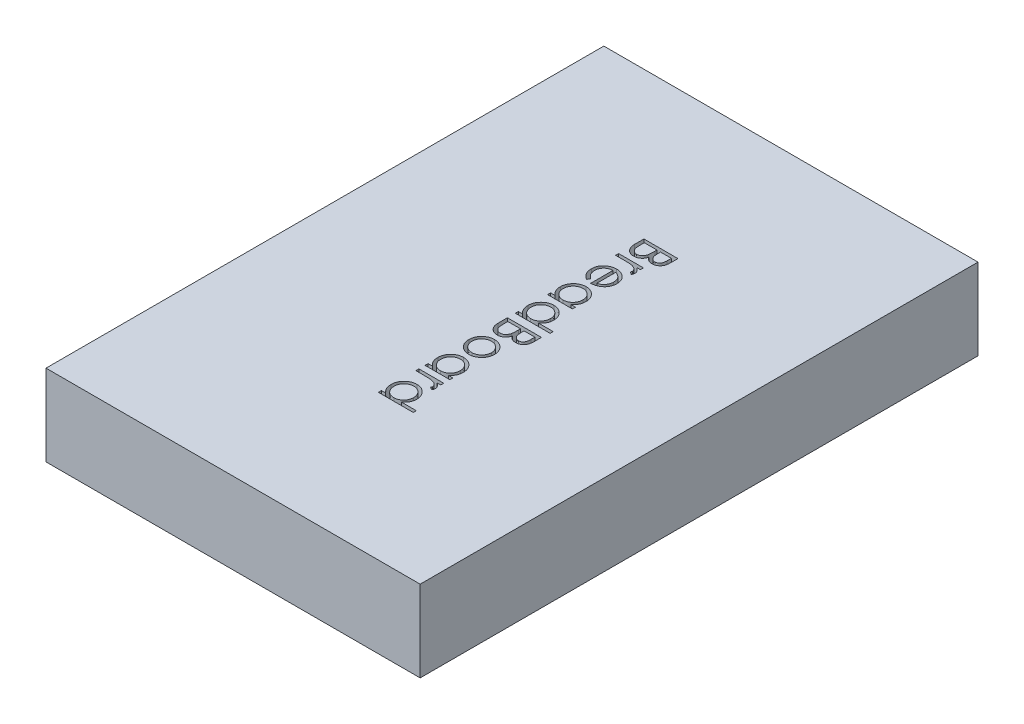
from build123d import *

# Parameters (mm, degrees)
SKETCH1_W           = 55
SKETCH1_H           = 82
BOSS_EXTRUDE1_DEPTH = 11.938
CUT_EXTRUDE1_DEPTH  = 2.54


with BuildPart() as part:
    # Sketch1 → Boss-Extrude1 (new body)
    with BuildSketch(Plane(origin=(0, 0, 0), x_dir=(1, 0, 0), z_dir=(0, 1, 0))):
        with Locations((-90.622842697, 15.300419944)):
            Rectangle(SKETCH1_W, SKETCH1_H)
    extrude(amount=BOSS_EXTRUDE1_DEPTH)

    # Sketch2 → Cut-Extrude1 (cut)
    # profile 1 of 10: a face of its own
    with BuildSketch(Plane(origin=(0, 11.938, 0), x_dir=(1, 0, 0), z_dir=(0, 1, 0))):
        with BuildLine():
            Line((-85.622842697, 34.691445585), (-85.622842697, 33.715884687))
            add(Edge.make_bspline(
                [(-85.622842697, 33.715884687), (-85.623093769, 33.668129719), (-85.623580409, 33.575568704), (-85.631127739, 33.440969501), (-85.641418696, 33.314899772), (-85.6577474, 33.197322954), (-85.677449938, 33.088293379), (-85.701309676, 32.987482469), (-85.729919124, 32.895210794), (-85.775413811, 32.785049742), (-85.843018337, 32.659448798), (-85.942916288, 32.523451094), (-86.065105521, 32.407159324), (-86.202937886, 32.306893156), (-86.354560417, 32.227177271), (-86.516359258, 32.169506846), (-86.68624746, 32.132995596), (-86.802880572, 32.12924069), (-86.861825068, 32.127343021)],
                knots=[0, 0, 0, 0, 1.001505555, 1.941167018, 2.826882275, 3.653841531, 4.429895133, 5.150066043, 5.825578002, 6.45369114, 7.647487171, 8.808567382, 9.977351308, 11.170798116, 12.373658725, 13.556498008, 14.765093433, 16, 16, 16, 16], degree=3))
            add(Edge.make_bspline(
                [(-86.861825068, 32.127343021), (-86.917052361, 32.128874578), (-87.025579199, 32.131884231), (-87.184056012, 32.161643734), (-87.335533942, 32.20595139), (-87.47814558, 32.270273014), (-87.610058058, 32.353010527), (-87.730487426, 32.452575575), (-87.836515177, 32.57112078), (-87.895543353, 32.660080297), (-87.925526992, 32.7052677)],
                knots=[0, 0, 0, 0, 1.044266239, 2.052081639, 3.041743201, 4.026043445, 5.00270663, 5.980942822, 6.97441044, 8, 8, 8, 8], degree=3))
            add(Edge.make_bspline(
                [(-87.925526992, 32.7052677), (-87.947317304, 32.648457577), (-87.989007571, 32.539765737), (-88.063116527, 32.390083859), (-88.142812626, 32.260605712), (-88.230305402, 32.15118878), (-88.32579265, 32.059021947), (-88.427362291, 31.976254218), (-88.54001474, 31.906913419), (-88.660542296, 31.847343827), (-88.788099039, 31.800463182), (-88.9221016, 31.76729205), (-89.06105159, 31.746910004), (-89.155760128, 31.744130709), (-89.203571863, 31.742727636)],
                knots=[0, 0, 0, 0, 1.272302504, 2.434229863, 3.488457646, 4.447234501, 5.35599188, 6.26022912, 7.18267843, 8.11661068, 9.06895546, 10.019249207, 11.000057067, 12, 12, 12, 12], degree=3))
            add(Edge.make_bspline(
                [(-89.203571863, 31.742727636), (-89.252381404, 31.744123568), (-89.348415542, 31.746870104), (-89.489498259, 31.767120951), (-89.624305083, 31.801442666), (-89.753794511, 31.848602575), (-89.877233586, 31.910501909), (-89.996168281, 31.984207884), (-90.107430254, 32.073917397), (-90.213665439, 32.173911348), (-90.309127399, 32.287165255), (-90.394115051, 32.409339626), (-90.464329321, 32.542191733), (-90.522573774, 32.683661389), (-90.567712927, 32.834688665), (-90.59905062, 32.994713589), (-90.620215163, 33.163770936), (-90.621951991, 33.279785701), (-90.622842697, 33.339282123)],
                knots=[0, 0, 0, 0, 0.978404568, 1.925038397, 2.85041836, 3.763147166, 4.682162379, 5.614488577, 6.562659439, 7.54271123, 8.535210642, 9.526693784, 10.520907202, 11.541451354, 12.589717429, 13.675358278, 14.807842563, 16, 16, 16, 16], degree=3))
            Line((-90.622842697, 33.339282123), (-90.622842697, 34.691445585))
            Line((-90.622842697, 34.691445585), (-85.622842697, 34.691445585))
        make_face()
        with BuildLine():
            Line((-86.135663209, 34.242727636), (-87.738227312, 34.242727636))
            Line((-87.738227312, 34.242727636), (-87.738227312, 33.941245264))
            add(Edge.make_bspline(
                [(-87.738227312, 33.941245264), (-87.737660748, 33.89717516), (-87.73656603, 33.812022737), (-87.733331347, 33.688380893), (-87.724670721, 33.573899009), (-87.715510682, 33.468182601), (-87.701406095, 33.371940228), (-87.684146043, 33.284849695), (-87.666051541, 33.206128657), (-87.635192679, 33.115387274), (-87.590048921, 33.012487748), (-87.518342093, 32.903490157), (-87.435254112, 32.80583978), (-87.337613305, 32.724302946), (-87.231011175, 32.657020805), (-87.115438219, 32.612119624), (-86.995406366, 32.580271807), (-86.912787123, 32.57747896), (-86.870839492, 32.576060969)],
                knots=[0, 0, 0, 0, 1.156481963, 2.23455883, 3.244418989, 4.168404366, 5.01828131, 5.794834307, 6.498111525, 7.13526334, 8.307595709, 9.435046769, 10.546766856, 11.659452936, 12.760769924, 13.837671619, 14.902137667, 16, 16, 16, 16], degree=3))
            add(Edge.make_bspline(
                [(-86.870839492, 32.576060969), (-86.843075319, 32.576770166), (-86.788612863, 32.578161333), (-86.709524959, 32.590822605), (-86.634190941, 32.609194234), (-86.564343439, 32.637896322), (-86.497997187, 32.67260308), (-86.438099066, 32.717750274), (-86.3813675, 32.768736763), (-86.329885532, 32.828615432), (-86.283757487, 32.897096345), (-86.243168854, 32.974831998), (-86.211151379, 33.062750595), (-86.182429999, 33.158858683), (-86.162500492, 33.264694384), (-86.14583677, 33.379223541), (-86.137366139, 33.503417738), (-86.136243514, 33.589339063), (-86.135663209, 33.633753277)],
                knots=[0, 0, 0, 0, 0.911752476, 1.788502045, 2.626783689, 3.45400582, 4.26402138, 5.080402872, 5.911472738, 6.767166405, 7.66795952, 8.620018292, 9.640966946, 10.73819047, 11.913090943, 13.176185384, 14.540321519, 16, 16, 16, 16], degree=3))
            Line((-86.135663209, 33.633753277), (-86.135663209, 34.242727636))
        make_face(mode=Mode.SUBTRACT)
        with BuildLine():
            Line((-88.251047825, 34.242727636), (-90.110022184, 34.242727636))
            Line((-90.110022184, 34.242727636), (-90.110022184, 33.6037052))
            add(Edge.make_bspline(
                [(-90.110022184, 33.6037052), (-90.109475888, 33.557963651), (-90.108422975, 33.469802844), (-90.104948126, 33.342518391), (-90.097210156, 33.22486358), (-90.084595199, 33.116770707), (-90.071487161, 33.017288262), (-90.053345001, 32.927404605), (-90.032719559, 32.846981936), (-90.000800711, 32.753741664), (-89.951298857, 32.648679713), (-89.876174494, 32.535538569), (-89.787853895, 32.433942467), (-89.684345405, 32.348657628), (-89.572649718, 32.278232751), (-89.45335104, 32.228839676), (-89.330088817, 32.197080637), (-89.245829078, 32.193327717), (-89.203571863, 32.191445585)],
                knots=[0, 0, 0, 0, 1.159821618, 2.235403267, 3.228114831, 4.14795534, 4.994323282, 5.771256229, 6.471395042, 7.097801288, 8.267864287, 9.404187171, 10.531774336, 11.667624178, 12.792825787, 13.866573821, 14.930062559, 16, 16, 16, 16], degree=3))
            add(Edge.make_bspline(
                [(-89.203571863, 32.191445585), (-89.177149387, 32.191830287), (-89.124730633, 32.192593485), (-89.047757865, 32.204536258), (-88.972864164, 32.221197206), (-88.901182033, 32.24532369), (-88.83154505, 32.275745231), (-88.765166182, 32.313923112), (-88.700458287, 32.35801133), (-88.618746879, 32.426979872), (-88.524569413, 32.527201144), (-88.432376427, 32.669647561), (-88.358021444, 32.83160568), (-88.326450902, 32.949073856), (-88.310142376, 33.00975488)],
                knots=[0, 0, 0, 0, 0.723503378, 1.435336582, 2.130201219, 2.824764462, 3.504949994, 4.209866579, 4.920640069, 5.648298893, 7.13757748, 8.670694625, 10.280166878, 12, 12, 12, 12], degree=3))
            add(Edge.make_bspline(
                [(-88.310142376, 33.00975488), (-88.30520621, 33.034082137), (-88.294503584, 33.086828648), (-88.283213245, 33.172839914), (-88.273085443, 33.271363276), (-88.265790597, 33.381977627), (-88.257959706, 33.505122895), (-88.255022644, 33.640759519), (-88.251437806, 33.788983387), (-88.251181144, 33.891829759), (-88.251047825, 33.945251675)],
                knots=[0, 0, 0, 0, 0.634452549, 1.375623993, 2.216454381, 3.166361212, 4.209414599, 5.370755378, 6.634280627, 8, 8, 8, 8], degree=3))
            Line((-88.251047825, 33.945251675), (-88.251047825, 34.242727636))
        make_face(mode=Mode.SUBTRACT)
    # profile 2 of 10: a face of its own
    with BuildSketch(Plane(origin=(0, 11.938, 0), x_dir=(1, 0, 0), z_dir=(0, 1, 0))):
        with BuildLine():
            Line((-86.968996543, 30.973496867), (-86.968996543, 30.524778918))
            Line((-86.968996543, 30.524778918), (-87.50685712, 30.524778918))
            add(Edge.make_bspline(
                [(-87.50685712, 30.524778918), (-87.456772125, 30.4916561), (-87.360984963, 30.428308967), (-87.234382516, 30.322953144), (-87.129091658, 30.215069513), (-87.046140514, 30.103316402), (-86.98350863, 29.988628027), (-86.937247354, 29.872911483), (-86.910356826, 29.753769663), (-86.906717367, 29.673545414), (-86.904893979, 29.633352636)],
                knots=[0, 0, 0, 0, 1.280622107, 2.44917983, 3.507334186, 4.490567186, 5.408878616, 6.288712897, 7.142636019, 8, 8, 8, 8], degree=3))
            add(Edge.make_bspline(
                [(-86.904893979, 29.633352636), (-86.906556683, 29.602162067), (-86.909960487, 29.538310304), (-86.935072486, 29.441358711), (-86.973643874, 29.341056978), (-87.010803183, 29.276330267), (-87.030094299, 29.242727636)],
                knots=[0, 0, 0, 0, 0.90119973, 1.844890732, 2.881183062, 4, 4, 4, 4], degree=3))
            Line((-87.030094299, 29.242727636), (-87.418716094, 29.489121867))
            add(Edge.make_bspline(
                [(-87.418716094, 29.489121867), (-87.409087142, 29.510706183), (-87.390809549, 29.551677346), (-87.369178106, 29.611612441), (-87.356441083, 29.666871494), (-87.354511487, 29.702076577), (-87.353611927, 29.718488854)],
                knots=[0, 0, 0, 0, 1.180555205, 2.24091978, 3.179933427, 4, 4, 4, 4], degree=3))
            add(Edge.make_bspline(
                [(-87.353611927, 29.718488854), (-87.355923734, 29.754858882), (-87.360597031, 29.82838059), (-87.399954562, 29.93616666), (-87.46086934, 30.041232186), (-87.530830565, 30.123610701), (-87.597001797, 30.187883817), (-87.655101869, 30.233775095), (-87.720205399, 30.275899944), (-87.791250367, 30.316141183), (-87.869435114, 30.352807882), (-87.953982778, 30.387028674), (-88.044990043, 30.417969954), (-88.108393652, 30.435613153), (-88.140871543, 30.444650713)],
                knots=[0, 0, 0, 0, 1.135927944, 2.296268816, 3.551388088, 4.924624343, 5.663947748, 6.437790805, 7.238014523, 8.089896346, 8.992356783, 9.939655789, 10.944608424, 12, 12, 12, 12], degree=3))
            add(Edge.make_bspline(
                [(-88.140871543, 30.444650713), (-88.169838934, 30.451411275), (-88.233999503, 30.466385406), (-88.341640253, 30.480944746), (-88.468816908, 30.495329771), (-88.615883469, 30.505467798), (-88.782472675, 30.514865001), (-88.968838312, 30.520165118), (-89.17517167, 30.524598176), (-89.319420746, 30.524716843), (-89.394877953, 30.524778918)],
                knots=[0, 0, 0, 0, 0.566838948, 1.255505196, 2.06880316, 3.007127437, 4.065329342, 5.249902469, 6.561414163, 8, 8, 8, 8], degree=3))
            Line((-89.394877953, 30.524778918), (-90.622842697, 30.524778918))
            Line((-90.622842697, 30.524778918), (-90.622842697, 30.973496867))
            Line((-90.622842697, 30.973496867), (-86.968996543, 30.973496867))
        make_face()
    # profile 3 of 10: a face of its own
    with BuildSketch(Plane(origin=(0, 11.938, 0), x_dir=(1, 0, 0), z_dir=(0, 1, 0))):
        with BuildLine():
            Line((-89.468996543, 25.731109046), (-89.678331479, 25.332471226))
            add(Edge.make_bspline(
                [(-89.678331479, 25.332471226), (-89.734674486, 25.36424236), (-89.844295665, 25.426056406), (-89.994976089, 25.532280249), (-90.130063389, 25.64376733), (-90.247466342, 25.764362788), (-90.349256021, 25.892581315), (-90.437727083, 26.028611262), (-90.513948929, 26.171998075), (-90.577824979, 26.323247208), (-90.626996906, 26.483665403), (-90.661712852, 26.653698884), (-90.68317589, 26.833657393), (-90.685668777, 26.957009187), (-90.686945261, 27.020171546)],
                knots=[0, 0, 0, 0, 1.120373846, 2.179803828, 3.190307243, 4.151866639, 5.090753574, 6.023181945, 6.960194942, 7.901556876, 8.864247182, 9.862852693, 10.905672442, 12, 12, 12, 12], degree=3))
            add(Edge.make_bspline(
                [(-90.686945261, 27.020171546), (-90.685306439, 27.090374371), (-90.682109572, 27.227319744), (-90.65454891, 27.426662245), (-90.609588391, 27.614347112), (-90.546780497, 27.790363887), (-90.464741382, 27.95428119), (-90.364799566, 28.106426014), (-90.247466634, 28.24759394), (-90.111733182, 28.373353538), (-89.966457201, 28.48651928), (-89.815149636, 28.586557184), (-89.657733541, 28.669607743), (-89.496657031, 28.739449368), (-89.330437736, 28.792365847), (-89.159986654, 28.831100805), (-88.984459181, 28.853003793), (-88.865755226, 28.856400512), (-88.805935645, 28.858112252)],
                knots=[0, 0, 0, 0, 1.145226127, 2.234004399, 3.276654467, 4.290038057, 5.276870678, 6.260645262, 7.254731018, 8.264593254, 9.273837991, 10.257612574, 11.220387342, 12.174754112, 13.118989047, 14.062768009, 15.023752772, 16, 16, 16, 16], degree=3))
            add(Edge.make_bspline(
                [(-88.805935645, 28.858112252), (-88.749800173, 28.856599192), (-88.638547081, 28.853600509), (-88.473882017, 28.834699384), (-88.313841371, 28.801201823), (-88.158292159, 28.755235646), (-88.007494825, 28.695876723), (-87.861357591, 28.623259267), (-87.720035963, 28.537270156), (-87.630888629, 28.470880622), (-87.585983722, 28.437439175)],
                knots=[0, 0, 0, 0, 1.024358464, 2.0301432, 3.019427413, 4.004406732, 4.986367066, 5.972626655, 6.978780325, 8, 8, 8, 8], degree=3))
            add(Edge.make_bspline(
                [(-87.585983722, 28.437439175), (-87.531885336, 28.392142485), (-87.425402264, 28.30298399), (-87.28549037, 28.152189196), (-87.168284977, 27.988903202), (-87.071131926, 27.815172307), (-86.99731243, 27.628977344), (-86.942301598, 27.432821214), (-86.911475868, 27.224470377), (-86.90712182, 27.082034347), (-86.904893979, 27.009153918)],
                knots=[0, 0, 0, 0, 1.030682036, 2.02871468, 2.997146059, 3.962720338, 4.930598197, 5.918074684, 6.934738563, 8, 8, 8, 8], degree=3))
            add(Edge.make_bspline(
                [(-86.904893979, 27.009153918), (-86.906828334, 26.934228768), (-86.910623099, 26.787242702), (-86.945803575, 26.572911101), (-87.001592939, 26.370110077), (-87.080384068, 26.178920785), (-87.182040571, 25.999323841), (-87.307957487, 25.832486628), (-87.45426904, 25.675555895), (-87.566787911, 25.584257926), (-87.62404462, 25.537799752)],
                knots=[0, 0, 0, 0, 1.056321875, 2.072262726, 3.055038591, 4.01806755, 4.982017516, 5.957941055, 6.960871419, 8, 8, 8, 8], degree=3))
            add(Edge.make_bspline(
                [(-87.62404462, 25.537799752), (-87.667192593, 25.50618984), (-87.753201334, 25.443180421), (-87.893445844, 25.364255992), (-88.040175265, 25.295745428), (-88.195761403, 25.240984055), (-88.358360804, 25.196641911), (-88.529135868, 25.164560741), (-88.708035741, 25.145747), (-88.82993082, 25.142048861), (-88.892073466, 25.140163534)],
                knots=[0, 0, 0, 0, 0.94817472, 1.890038105, 2.849395472, 3.817997239, 4.812318967, 5.836947057, 6.897266129, 8, 8, 8, 8], degree=3))
            Line((-88.892073466, 25.140163534), (-88.892073466, 28.409394303))
            add(Edge.make_bspline(
                [(-88.892073466, 28.409394303), (-88.940216012, 28.407192776), (-89.034886389, 28.402863564), (-89.173429919, 28.38272876), (-89.305341683, 28.350837221), (-89.430059638, 28.306507054), (-89.547993273, 28.2509216), (-89.659955373, 28.184971038), (-89.764245582, 28.105809452), (-89.862215369, 28.017660032), (-89.949428859, 27.919493599), (-90.02754949, 27.81625559), (-90.092663259, 27.706590984), (-90.146311996, 27.591605295), (-90.187603657, 27.470702201), (-90.216038499, 27.344051722), (-90.235034404, 27.212047844), (-90.237150179, 27.122069131), (-90.238227312, 27.07626129)],
                knots=[0, 0, 0, 0, 1.094405546, 2.152104367, 3.174987145, 4.173015398, 5.153654967, 6.133208507, 7.119289451, 8.123438607, 9.122504012, 10.097966803, 11.060604936, 12.014205423, 12.976096155, 13.956823727, 14.959826266, 16, 16, 16, 16], degree=3))
            add(Edge.make_bspline(
                [(-90.238227312, 27.07626129), (-90.237364701, 27.031472796), (-90.235653114, 26.942603831), (-90.218762884, 26.809951653), (-90.191899169, 26.679374328), (-90.154976155, 26.551809724), (-90.109491539, 26.430031423), (-90.054970104, 26.316929691), (-89.995348644, 26.212123502), (-89.926085737, 26.114733842), (-89.842184896, 26.020269569), (-89.736284746, 25.927741205), (-89.61232343, 25.827187663), (-89.518645135, 25.764390786), (-89.468996543, 25.731109046)],
                knots=[0, 0, 0, 0, 0.990963276, 1.966261236, 2.95471375, 3.93937425, 4.902926125, 5.828461241, 6.715766441, 7.568835615, 8.469155523, 9.505141836, 10.677749234, 12, 12, 12, 12], degree=3))
        make_face()
        with BuildLine():
            add(Edge.make_bspline(
                [(-88.443355517, 25.588881482), (-88.383822742, 25.605277223), (-88.269241314, 25.636833746), (-88.110948077, 25.703196255), (-87.969450904, 25.776234889), (-87.847086115, 25.864393361), (-87.739166654, 25.965141332), (-87.6439026, 26.080281986), (-87.559086713, 26.209544314), (-87.48742146, 26.352037975), (-87.426441152, 26.502960174), (-87.385546737, 26.660967584), (-87.357533471, 26.822193373), (-87.354924695, 26.931242302), (-87.353611927, 26.986117059)],
                knots=[0, 0, 0, 0, 1.154756201, 2.222533969, 3.206705588, 4.129403772, 5.035894089, 5.963342549, 6.920206228, 7.923656548, 8.944970878, 9.96070521, 10.973801891, 12, 12, 12, 12], degree=3))
            add(Edge.make_bspline(
                [(-87.353611927, 26.986117059), (-87.354489432, 27.030900731), (-87.356224074, 27.119428636), (-87.372556686, 27.249876648), (-87.399905373, 27.375379576), (-87.436326715, 27.496628449), (-87.486507946, 27.611512799), (-87.544154168, 27.723022313), (-87.614978183, 27.828402579), (-87.668912554, 27.894321478), (-87.696160004, 27.927623469)],
                knots=[0, 0, 0, 0, 1.048700258, 2.073059931, 3.073189922, 4.055269162, 5.032885305, 6.005420607, 6.992345662, 8, 8, 8, 8], degree=3))
            add(Edge.make_bspline(
                [(-87.696160004, 27.927623469), (-87.717723312, 27.951471015), (-87.761362192, 27.999732635), (-87.836546773, 28.064219095), (-87.917620433, 28.125962627), (-88.007684897, 28.18215356), (-88.105714581, 28.233692969), (-88.210882632, 28.281921508), (-88.323987104, 28.325330668), (-88.402804874, 28.349753682), (-88.443355517, 28.362318982)],
                knots=[0, 0, 0, 0, 0.879870761, 1.780643979, 2.707998968, 3.669668524, 4.684282772, 5.740141944, 6.837334558, 8, 8, 8, 8], degree=3))
            Line((-88.443355517, 28.362318982), (-88.443355517, 25.588881482))
        make_face(mode=Mode.SUBTRACT)
    # profile 4 of 10: a face of its own
    with BuildSketch(Plane(origin=(0, 11.938, 0), x_dir=(1, 0, 0), z_dir=(0, 1, 0))):
        with BuildLine():
            Line((-86.968996543, 20.524778918), (-90.622842697, 20.524778918))
            Line((-90.622842697, 20.524778918), (-90.622842697, 20.973496867))
            Line((-90.622842697, 20.973496867), (-89.990831479, 20.973496867))
            add(Edge.make_bspline(
                [(-89.990831479, 20.973496867), (-90.048046337, 21.024084559), (-90.159701853, 21.122807076), (-90.305135801, 21.287664198), (-90.42633745, 21.461685795), (-90.52331862, 21.645460327), (-90.596722019, 21.838437946), (-90.648341417, 22.040068329), (-90.681944235, 22.250082751), (-90.685263296, 22.393305346), (-90.686945261, 22.465884687)],
                knots=[0, 0, 0, 0, 1.074295371, 2.096500925, 3.086030275, 4.053105238, 5.014108356, 5.985331429, 6.979048527, 8, 8, 8, 8], degree=3))
            add(Edge.make_bspline(
                [(-90.686945261, 22.465884687), (-90.685193591, 22.530410511), (-90.681739221, 22.657658292), (-90.65493175, 22.844840167), (-90.611903441, 23.024981262), (-90.551988213, 23.198196385), (-90.472922811, 23.363311861), (-90.377242755, 23.521258073), (-90.264419067, 23.672403639), (-90.134935302, 23.813874086), (-89.994446266, 23.944313344), (-89.844165638, 24.058434521), (-89.68615752, 24.155155933), (-89.52046632, 24.234643611), (-89.347213158, 24.296155345), (-89.16651689, 24.338950868), (-88.978678185, 24.365729451), (-88.850764035, 24.369182071), (-88.785903594, 24.370932764)],
                knots=[0, 0, 0, 0, 1.034036272, 2.039165313, 3.024406509, 3.999331371, 4.971254918, 5.953351348, 6.95522652, 7.989525907, 9.023492927, 10.024309745, 11.009187477, 11.988246066, 12.964946762, 13.950187958, 14.960617622, 16, 16, 16, 16], degree=3))
            add(Edge.make_bspline(
                [(-88.785903594, 24.370932764), (-88.722383747, 24.369143241), (-88.596808435, 24.365605451), (-88.412128494, 24.339237407), (-88.23423082, 24.294930656), (-88.063774412, 24.232633272), (-87.900072786, 24.153103324), (-87.744406748, 24.054718522), (-87.594395043, 23.94063847), (-87.454848283, 23.808805146), (-87.326415035, 23.66606495), (-87.213317163, 23.51407374), (-87.117882422, 23.354726694), (-87.040303256, 23.187704299), (-86.978654128, 23.014189221), (-86.935678749, 22.832863359), (-86.910416106, 22.64455131), (-86.906752374, 22.516709094), (-86.904893979, 22.451862252)],
                knots=[0, 0, 0, 0, 1.02050356, 2.017480486, 2.990790918, 3.96161403, 4.928589988, 5.909588639, 6.91611943, 7.952353252, 8.989586576, 9.99823133, 10.991940466, 11.968822692, 12.952985106, 13.945868367, 14.958059758, 16, 16, 16, 16], degree=3))
            add(Edge.make_bspline(
                [(-86.904893979, 22.451862252), (-86.906937909, 22.377288122), (-86.910945959, 22.231051772), (-86.9446557, 22.016876935), (-87.000905839, 21.814079564), (-87.078214095, 21.621490708), (-87.180184326, 21.439857467), (-87.30997662, 21.271415261), (-87.464625875, 21.112773077), (-87.583757969, 21.020824914), (-87.645078274, 20.973496867)],
                knots=[0, 0, 0, 0, 1.03879612, 2.037030165, 3.012306674, 3.966139504, 4.922386257, 5.905048148, 6.921675258, 8, 8, 8, 8], degree=3))
            Line((-87.645078274, 20.973496867), (-86.968996543, 20.973496867))
            Line((-86.968996543, 20.973496867), (-86.968996543, 20.524778918))
        make_face()
        with BuildLine():
            add(Edge.make_bspline(
                [(-87.353611927, 22.445852636), (-87.35594567, 22.511444587), (-87.360552108, 22.640912665), (-87.396514607, 22.830974954), (-87.456348377, 23.012853405), (-87.538184799, 23.185625442), (-87.641063955, 23.346609961), (-87.765593488, 23.490347385), (-87.907813315, 23.618557381), (-88.068919147, 23.724559194), (-88.23966279, 23.813929268), (-88.419502756, 23.875214951), (-88.60344976, 23.915996433), (-88.728261622, 23.920136624), (-88.790911607, 23.922214816)],
                knots=[0, 0, 0, 0, 1.031093775, 2.03521511, 3.029845951, 4.035119871, 5.034286494, 6.024708811, 7.017619509, 8.03559408, 9.050082311, 10.039808432, 11.016071318, 12, 12, 12, 12], degree=3))
            add(Edge.make_bspline(
                [(-88.790911607, 23.922214816), (-88.853174851, 23.919526124), (-88.977457288, 23.914159278), (-89.161950824, 23.876289921), (-89.341066802, 23.810675163), (-89.514175618, 23.72334497), (-89.67561214, 23.614965454), (-89.82061306, 23.487819518), (-89.945642009, 23.342249179), (-90.050291278, 23.180915471), (-90.134528964, 23.00886522), (-90.19392861, 22.827848589), (-90.231436288, 22.641046097), (-90.235956023, 22.513802431), (-90.238227312, 22.449859046)],
                knots=[0, 0, 0, 0, 0.979154363, 1.954470772, 2.947816011, 3.971783346, 4.997163654, 5.998045606, 6.995988793, 8.00538986, 9.015323546, 10.000094788, 10.994993517, 12, 12, 12, 12], degree=3))
            add(Edge.make_bspline(
                [(-90.238227312, 22.449859046), (-90.235891449, 22.384927757), (-90.231257465, 22.256114307), (-90.194693534, 22.065604678), (-90.135603718, 21.880440487), (-90.052595989, 21.703376112), (-89.950192521, 21.538549753), (-89.829779804, 21.390803885), (-89.690913955, 21.264645596), (-89.537072052, 21.158885235), (-89.369207873, 21.07533985), (-89.189722449, 21.016414209), (-89.000026277, 20.980222856), (-88.87020085, 20.975769863), (-88.80393244, 20.973496867)],
                knots=[0, 0, 0, 0, 1.017484689, 2.018529338, 3.030031036, 4.058138743, 5.076350332, 6.065651025, 7.036469986, 8.00785331, 8.984076697, 9.96571663, 10.961615403, 12, 12, 12, 12], degree=3))
            add(Edge.make_bspline(
                [(-88.80393244, 20.973496867), (-88.753449845, 20.974867826), (-88.654084121, 20.977566308), (-88.508187389, 20.998181098), (-88.3685688, 21.030974983), (-88.235075535, 21.077179673), (-88.108467874, 21.137896845), (-87.987753389, 21.211050138), (-87.874056519, 21.298140035), (-87.76752125, 21.396516168), (-87.670836473, 21.505411926), (-87.585619322, 21.621208451), (-87.513502163, 21.743614401), (-87.455789573, 21.872543853), (-87.408772573, 22.007003783), (-87.377718657, 22.148282966), (-87.356327301, 22.294957564), (-87.354526582, 22.39502469), (-87.353611927, 22.445852636)],
                knots=[0, 0, 0, 0, 1.050062701, 2.066855696, 3.059271411, 4.030305351, 4.999747758, 5.975466543, 6.961907836, 7.974539719, 8.98812422, 9.98710676, 10.961662635, 11.93785114, 12.922015094, 13.919620009, 14.94329489, 16, 16, 16, 16], degree=3))
        make_face(mode=Mode.SUBTRACT)
    # profile 5 of 10: a face of its own
    with BuildSketch(Plane(origin=(0, 11.938, 0), x_dir=(1, 0, 0), z_dir=(0, 1, 0))):
        with BuildLine():
            Line((-85.494637568, 15.781189175), (-90.622842697, 15.781189175))
            Line((-90.622842697, 15.781189175), (-90.622842697, 16.229907123))
            Line((-90.622842697, 16.229907123), (-89.990831479, 16.229907123))
            add(Edge.make_bspline(
                [(-89.990831479, 16.229907123), (-90.048046337, 16.280494815), (-90.159701853, 16.379217332), (-90.305135801, 16.544074455), (-90.42633745, 16.718096051), (-90.52331862, 16.901870583), (-90.596722019, 17.094848202), (-90.648341417, 17.296478585), (-90.681944235, 17.506493008), (-90.685263296, 17.649715602), (-90.686945261, 17.722294944)],
                knots=[0, 0, 0, 0, 1.074295371, 2.096500925, 3.086030275, 4.053105238, 5.014108356, 5.985331429, 6.979048527, 8, 8, 8, 8], degree=3))
            add(Edge.make_bspline(
                [(-90.686945261, 17.722294944), (-90.685193591, 17.786820768), (-90.681739221, 17.914068549), (-90.65493175, 18.101250423), (-90.611903441, 18.281391518), (-90.551988213, 18.454606641), (-90.472922811, 18.619722118), (-90.377242755, 18.77766833), (-90.264419067, 18.928813896), (-90.134935302, 19.070284343), (-89.994446266, 19.200723601), (-89.844165638, 19.314844777), (-89.68615752, 19.411566189), (-89.52046632, 19.491053868), (-89.347213158, 19.552565601), (-89.16651689, 19.595361124), (-88.978678185, 19.622139707), (-88.850764035, 19.625592327), (-88.785903594, 19.627343021)],
                knots=[0, 0, 0, 0, 1.034036272, 2.039165313, 3.024406509, 3.999331371, 4.971254918, 5.953351348, 6.95522652, 7.989525907, 9.023492927, 10.024309745, 11.009187477, 11.988246066, 12.964946762, 13.950187958, 14.960617622, 16, 16, 16, 16], degree=3))
            add(Edge.make_bspline(
                [(-88.785903594, 19.627343021), (-88.722383747, 19.625553498), (-88.596808435, 19.622015707), (-88.412128494, 19.595647664), (-88.23423082, 19.551340912), (-88.063774412, 19.489043528), (-87.900072786, 19.409513581), (-87.744406748, 19.311128779), (-87.594395043, 19.197048726), (-87.454848283, 19.065215403), (-87.326415035, 18.922475206), (-87.213317163, 18.770483996), (-87.117882422, 18.61113695), (-87.040303256, 18.444114555), (-86.978654128, 18.270599478), (-86.935678749, 18.089273616), (-86.910416106, 17.900961567), (-86.906752374, 17.77311935), (-86.904893979, 17.708272508)],
                knots=[0, 0, 0, 0, 1.02050356, 2.017480486, 2.990790918, 3.96161403, 4.928589988, 5.909588639, 6.91611943, 7.952353252, 8.989586576, 9.99823133, 10.991940466, 11.968822692, 12.952985106, 13.945868367, 14.958059758, 16, 16, 16, 16], degree=3))
            add(Edge.make_bspline(
                [(-86.904893979, 17.708272508), (-86.907122084, 17.633673741), (-86.911495606, 17.487244652), (-86.948423927, 17.272835114), (-87.009681576, 17.069815393), (-87.094398919, 16.877469745), (-87.203719533, 16.6969415), (-87.336910175, 16.527489271), (-87.495536495, 16.370381035), (-87.615013017, 16.277445663), (-87.676127953, 16.229907123)],
                knots=[0, 0, 0, 0, 1.030970925, 2.023681352, 2.997808474, 3.956843046, 4.921958419, 5.908293655, 6.930045022, 8, 8, 8, 8], degree=3))
            Line((-87.676127953, 16.229907123), (-85.494637568, 16.229907123))
            Line((-85.494637568, 16.229907123), (-85.494637568, 15.781189175))
        make_face()
        with BuildLine():
            add(Edge.make_bspline(
                [(-87.353611927, 17.702262893), (-87.35594567, 17.767854843), (-87.360552108, 17.897322921), (-87.396514607, 18.08738521), (-87.456348377, 18.269263662), (-87.538184799, 18.442035698), (-87.641063955, 18.603020218), (-87.765593488, 18.746757641), (-87.907813315, 18.874967637), (-88.068919147, 18.980969451), (-88.23966279, 19.070339525), (-88.419502756, 19.131625207), (-88.60344976, 19.17240669), (-88.728261622, 19.176546881), (-88.790911607, 19.178625072)],
                knots=[0, 0, 0, 0, 1.031093775, 2.03521511, 3.029845951, 4.035119871, 5.034286494, 6.024708811, 7.017619509, 8.03559408, 9.050082311, 10.039808432, 11.016071318, 12, 12, 12, 12], degree=3))
            add(Edge.make_bspline(
                [(-88.790911607, 19.178625072), (-88.853174851, 19.17593638), (-88.977457288, 19.170569535), (-89.161950824, 19.132700178), (-89.341066802, 19.06708542), (-89.514175618, 18.979755227), (-89.67561214, 18.871375711), (-89.82061306, 18.744229774), (-89.945642009, 18.598659436), (-90.050291278, 18.437325727), (-90.134528964, 18.265275476), (-90.19392861, 18.084258846), (-90.231436288, 17.897456354), (-90.235956023, 17.770212688), (-90.238227312, 17.706269303)],
                knots=[0, 0, 0, 0, 0.979154363, 1.954470772, 2.947816011, 3.971783346, 4.997163654, 5.998045606, 6.995988793, 8.00538986, 9.015323546, 10.000094788, 10.994993517, 12, 12, 12, 12], degree=3))
            add(Edge.make_bspline(
                [(-90.238227312, 17.706269303), (-90.235891449, 17.641338013), (-90.231257465, 17.512524563), (-90.194693534, 17.322014934), (-90.135603718, 17.136850744), (-90.052595989, 16.959786368), (-89.950192521, 16.794960009), (-89.829779804, 16.647214141), (-89.690913955, 16.521055853), (-89.537072052, 16.415295491), (-89.369207873, 16.331750106), (-89.189722449, 16.272824465), (-89.000026277, 16.236633113), (-88.87020085, 16.23218012), (-88.80393244, 16.229907123)],
                knots=[0, 0, 0, 0, 1.017484689, 2.018529338, 3.030031036, 4.058138743, 5.076350332, 6.065651025, 7.036469986, 8.00785331, 8.984076697, 9.96571663, 10.961615403, 12, 12, 12, 12], degree=3))
            add(Edge.make_bspline(
                [(-88.80393244, 16.229907123), (-88.753449845, 16.231278083), (-88.654084121, 16.233976564), (-88.508187389, 16.254591354), (-88.3685688, 16.28738524), (-88.235075535, 16.333589929), (-88.108467874, 16.394307101), (-87.987753389, 16.467460394), (-87.874056519, 16.554550291), (-87.76752125, 16.652926425), (-87.670836473, 16.761822182), (-87.585619322, 16.877618707), (-87.513502163, 17.000024657), (-87.455789573, 17.128954109), (-87.408772573, 17.26341404), (-87.377718657, 17.404693222), (-87.356327301, 17.551367821), (-87.354526582, 17.651434946), (-87.353611927, 17.702262893)],
                knots=[0, 0, 0, 0, 1.050062701, 2.066855696, 3.059271411, 4.030305351, 4.999747758, 5.975466543, 6.961907836, 7.974539719, 8.98812422, 9.98710676, 10.961662635, 11.93785114, 12.922015094, 13.919620009, 14.94329489, 16, 16, 16, 16], degree=3))
        make_face(mode=Mode.SUBTRACT)
    # profile 6 of 10: a face of its own
    with BuildSketch(Plane(origin=(0, 11.938, 0), x_dir=(1, 0, 0), z_dir=(0, 1, 0))):
        with BuildLine():
            Line((-85.622842697, 14.627343021), (-85.622842697, 13.651782123))
            add(Edge.make_bspline(
                [(-85.622842697, 13.651782123), (-85.623093769, 13.604027154), (-85.623580409, 13.51146614), (-85.631127739, 13.376866937), (-85.641418696, 13.250797208), (-85.6577474, 13.13322039), (-85.677449938, 13.024190815), (-85.701309676, 12.923379905), (-85.729919124, 12.83110823), (-85.775413811, 12.720947178), (-85.843018337, 12.595346234), (-85.942916288, 12.45934853), (-86.065105521, 12.34305676), (-86.202937886, 12.242790592), (-86.354560417, 12.163074707), (-86.516359258, 12.105404282), (-86.68624746, 12.068893032), (-86.802880572, 12.065138126), (-86.861825068, 12.063240457)],
                knots=[0, 0, 0, 0, 1.001505555, 1.941167018, 2.826882275, 3.653841531, 4.429895133, 5.150066043, 5.825578002, 6.45369114, 7.647487171, 8.808567382, 9.977351308, 11.170798116, 12.373658725, 13.556498008, 14.765093433, 16, 16, 16, 16], degree=3))
            add(Edge.make_bspline(
                [(-86.861825068, 12.063240457), (-86.917052361, 12.064772013), (-87.025579199, 12.067781667), (-87.184056012, 12.09754117), (-87.335533942, 12.141848826), (-87.47814558, 12.20617045), (-87.610058058, 12.288907963), (-87.730487426, 12.388473011), (-87.836515177, 12.507018216), (-87.895543353, 12.595977732), (-87.925526992, 12.641165136)],
                knots=[0, 0, 0, 0, 1.044266239, 2.052081639, 3.041743201, 4.026043445, 5.00270663, 5.980942822, 6.97441044, 8, 8, 8, 8], degree=3))
            add(Edge.make_bspline(
                [(-87.925526992, 12.641165136), (-87.947317304, 12.584355013), (-87.989007571, 12.475663173), (-88.063116527, 12.325981295), (-88.142812626, 12.196503148), (-88.230305402, 12.087086216), (-88.32579265, 11.994919383), (-88.427362291, 11.912151654), (-88.54001474, 11.842810855), (-88.660542296, 11.783241263), (-88.788099039, 11.736360618), (-88.9221016, 11.703189486), (-89.06105159, 11.68280744), (-89.155760128, 11.680028145), (-89.203571863, 11.678625072)],
                knots=[0, 0, 0, 0, 1.272302504, 2.434229863, 3.488457646, 4.447234501, 5.35599188, 6.26022912, 7.18267843, 8.11661068, 9.06895546, 10.019249207, 11.000057067, 12, 12, 12, 12], degree=3))
            add(Edge.make_bspline(
                [(-89.203571863, 11.678625072), (-89.252381404, 11.680021004), (-89.348415542, 11.68276754), (-89.489498259, 11.703018387), (-89.624305083, 11.737340101), (-89.753794511, 11.784500011), (-89.877233586, 11.846399345), (-89.996168281, 11.92010532), (-90.107430254, 12.009814833), (-90.213665439, 12.109808784), (-90.309127399, 12.223062691), (-90.394115051, 12.345237062), (-90.464329321, 12.478089168), (-90.522573774, 12.619558825), (-90.567712927, 12.770586101), (-90.59905062, 12.930611025), (-90.620215163, 13.099668372), (-90.621951991, 13.215683137), (-90.622842697, 13.275179559)],
                knots=[0, 0, 0, 0, 0.978404568, 1.925038397, 2.85041836, 3.763147166, 4.682162379, 5.614488577, 6.562659439, 7.54271123, 8.535210642, 9.526693784, 10.520907202, 11.541451354, 12.589717429, 13.675358278, 14.807842563, 16, 16, 16, 16], degree=3))
            Line((-90.622842697, 13.275179559), (-90.622842697, 14.627343021))
            Line((-90.622842697, 14.627343021), (-85.622842697, 14.627343021))
        make_face()
        with BuildLine():
            Line((-86.135663209, 14.178625072), (-87.738227312, 14.178625072))
            Line((-87.738227312, 14.178625072), (-87.738227312, 13.8771427))
            add(Edge.make_bspline(
                [(-87.738227312, 13.8771427), (-87.737660748, 13.833072596), (-87.73656603, 13.747920173), (-87.733331347, 13.624278328), (-87.724670721, 13.509796444), (-87.715510682, 13.404080037), (-87.701406095, 13.307837664), (-87.684146043, 13.220747131), (-87.666051541, 13.142026093), (-87.635192679, 13.051284709), (-87.590048921, 12.948385184), (-87.518342093, 12.839387593), (-87.435254112, 12.741737216), (-87.337613305, 12.660200382), (-87.231011175, 12.592918241), (-87.115438219, 12.54801706), (-86.995406366, 12.516169243), (-86.912787123, 12.513376396), (-86.870839492, 12.511958405)],
                knots=[0, 0, 0, 0, 1.156481963, 2.23455883, 3.244418989, 4.168404366, 5.01828131, 5.794834307, 6.498111525, 7.13526334, 8.307595709, 9.435046769, 10.546766856, 11.659452936, 12.760769924, 13.837671619, 14.902137667, 16, 16, 16, 16], degree=3))
            add(Edge.make_bspline(
                [(-86.870839492, 12.511958405), (-86.843075319, 12.512667602), (-86.788612863, 12.514058769), (-86.709524959, 12.526720041), (-86.634190941, 12.545091669), (-86.564343439, 12.573793758), (-86.497997187, 12.608500516), (-86.438099066, 12.65364771), (-86.3813675, 12.704634199), (-86.329885532, 12.764512868), (-86.283757487, 12.83299378), (-86.243168854, 12.910729433), (-86.211151379, 12.998648031), (-86.182429999, 13.094756119), (-86.162500492, 13.20059182), (-86.14583677, 13.315120977), (-86.137366139, 13.439315174), (-86.136243514, 13.525236498), (-86.135663209, 13.569650713)],
                knots=[0, 0, 0, 0, 0.911752476, 1.788502045, 2.626783689, 3.45400582, 4.26402138, 5.080402872, 5.911472738, 6.767166405, 7.66795952, 8.620018292, 9.640966946, 10.73819047, 11.913090943, 13.176185384, 14.540321519, 16, 16, 16, 16], degree=3))
            Line((-86.135663209, 13.569650713), (-86.135663209, 14.178625072))
        make_face(mode=Mode.SUBTRACT)
        with BuildLine():
            Line((-88.251047825, 14.178625072), (-90.110022184, 14.178625072))
            Line((-90.110022184, 14.178625072), (-90.110022184, 13.539602636))
            add(Edge.make_bspline(
                [(-90.110022184, 13.539602636), (-90.109475888, 13.493861087), (-90.108422975, 13.40570028), (-90.104948126, 13.278415827), (-90.097210156, 13.160761016), (-90.084595199, 13.052668143), (-90.071487161, 12.953185698), (-90.053345001, 12.863302041), (-90.032719559, 12.782879372), (-90.000800711, 12.6896391), (-89.951298857, 12.584577149), (-89.876174494, 12.471436005), (-89.787853895, 12.369839903), (-89.684345405, 12.284555063), (-89.572649718, 12.214130187), (-89.45335104, 12.164737112), (-89.330088817, 12.132978073), (-89.245829078, 12.129225153), (-89.203571863, 12.127343021)],
                knots=[0, 0, 0, 0, 1.159821618, 2.235403267, 3.228114831, 4.14795534, 4.994323282, 5.771256229, 6.471395042, 7.097801288, 8.267864287, 9.404187171, 10.531774336, 11.667624178, 12.792825787, 13.866573821, 14.930062559, 16, 16, 16, 16], degree=3))
            add(Edge.make_bspline(
                [(-89.203571863, 12.127343021), (-89.177149387, 12.127727723), (-89.124730633, 12.128490921), (-89.047757865, 12.140433694), (-88.972864164, 12.157094642), (-88.901182033, 12.181221126), (-88.83154505, 12.211642667), (-88.765166182, 12.249820547), (-88.700458287, 12.293908766), (-88.618746879, 12.362877308), (-88.524569413, 12.46309858), (-88.432376427, 12.605544997), (-88.358021444, 12.767503116), (-88.326450902, 12.884971292), (-88.310142376, 12.945652316)],
                knots=[0, 0, 0, 0, 0.723503378, 1.435336582, 2.130201219, 2.824764462, 3.504949994, 4.209866579, 4.920640069, 5.648298893, 7.13757748, 8.670694625, 10.280166878, 12, 12, 12, 12], degree=3))
            add(Edge.make_bspline(
                [(-88.310142376, 12.945652316), (-88.30520621, 12.969979573), (-88.294503584, 13.022726084), (-88.283213245, 13.10873735), (-88.273085443, 13.207260712), (-88.265790597, 13.317875063), (-88.257959706, 13.441020331), (-88.255022644, 13.576656955), (-88.251437806, 13.724880823), (-88.251181144, 13.827727195), (-88.251047825, 13.88114911)],
                knots=[0, 0, 0, 0, 0.634452549, 1.375623993, 2.216454381, 3.166361212, 4.209414599, 5.370755378, 6.634280627, 8, 8, 8, 8], degree=3))
            Line((-88.251047825, 13.88114911), (-88.251047825, 14.178625072))
        make_face(mode=Mode.SUBTRACT)
    # profile 7 of 10: a face of its own
    with BuildSketch(Plane(origin=(0, 11.938, 0), x_dir=(1, 0, 0), z_dir=(0, 1, 0))):
        with BuildLine():
            add(Edge.make_bspline(
                [(-86.904893979, 9.016365457), (-86.906349539, 8.947804794), (-86.909203537, 8.813374089), (-86.939857011, 8.61652978), (-86.986341047, 8.428824455), (-87.051773374, 8.249452915), (-87.137623143, 8.079898923), (-87.241441061, 7.918648643), (-87.363929513, 7.766025145), (-87.458734735, 7.674567489), (-87.50685712, 7.628144303)],
                knots=[0, 0, 0, 0, 1.054042676, 2.066720093, 3.05716247, 4.025731183, 4.997454851, 5.974904663, 6.97207755, 8, 8, 8, 8], degree=3))
            add(Edge.make_bspline(
                [(-87.50685712, 7.628144303), (-87.552877099, 7.588170083), (-87.644026445, 7.508995254), (-87.791820178, 7.407472798), (-87.944877465, 7.320013427), (-88.105230789, 7.249923482), (-88.271480319, 7.194659163), (-88.444197478, 7.155422454), (-88.623000831, 7.132083975), (-88.744434885, 7.12893688), (-88.805935645, 7.127343021)],
                knots=[0, 0, 0, 0, 1.025258237, 2.030674902, 3.01204498, 3.988269485, 4.97094183, 5.956517959, 6.965070386, 8, 8, 8, 8], degree=3))
            add(Edge.make_bspline(
                [(-88.805935645, 7.127343021), (-88.867792871, 7.128744931), (-88.990025633, 7.131515172), (-89.170053297, 7.157720338), (-89.344617334, 7.19847903), (-89.512986878, 7.256810236), (-89.675676703, 7.331607503), (-89.831975784, 7.422880038), (-89.982194175, 7.531267583), (-90.125049845, 7.654132292), (-90.256731154, 7.789913764), (-90.37143046, 7.937247617), (-90.470111201, 8.093345301), (-90.548491146, 8.260337704), (-90.611670842, 8.435847741), (-90.655237308, 8.620991767), (-90.681814034, 8.815604617), (-90.685210792, 8.94850384), (-90.686945261, 9.016365457)],
                knots=[0, 0, 0, 0, 0.998669827, 1.973418153, 2.932281609, 3.89081133, 4.846438734, 5.82045571, 6.809776312, 7.834649874, 8.860672198, 9.859676908, 10.845817165, 11.837296335, 12.833502054, 13.853824644, 14.904110009, 16, 16, 16, 16], degree=3))
            add(Edge.make_bspline(
                [(-90.686945261, 9.016365457), (-90.685196441, 9.084556291), (-90.68177129, 9.218111485), (-90.655435001, 9.413457134), (-90.611205352, 9.599380674), (-90.549273297, 9.775720914), (-90.469467412, 9.94271264), (-90.371814418, 10.099386717), (-90.256673073, 10.246790065), (-90.125065583, 10.382614107), (-89.982190121, 10.505467402), (-89.831976837, 10.613857893), (-89.675676429, 10.705129663), (-89.512986951, 10.779927129), (-89.344617315, 10.838258282), (-89.170053302, 10.879016988), (-88.990025631, 10.905222151), (-88.86779287, 10.907992392), (-88.805935645, 10.909394303)],
                knots=[0, 0, 0, 0, 1.099861214, 2.154133753, 3.1731438, 4.178222029, 5.163564916, 6.153006591, 7.15072618, 8.175428628, 9.198983792, 10.187031731, 11.15979573, 12.114193814, 13.071490482, 14.029120454, 15.002614863, 16, 16, 16, 16], degree=3))
            add(Edge.make_bspline(
                [(-88.805935645, 10.909394303), (-88.744769151, 10.907789574), (-88.623670005, 10.904612486), (-88.445202775, 10.881297473), (-88.272777934, 10.842213821), (-88.107170111, 10.786883254), (-87.947519488, 10.716147267), (-87.794084015, 10.629916856), (-87.646958586, 10.52735881), (-87.555927043, 10.448498879), (-87.509861927, 10.408593021)],
                knots=[0, 0, 0, 0, 1.031353054, 2.041901799, 3.029428768, 4.008703097, 4.981709435, 5.96992636, 6.972712378, 8, 8, 8, 8], degree=3))
            add(Edge.make_bspline(
                [(-87.509861927, 10.408593021), (-87.46133032, 10.362235981), (-87.365884374, 10.271066705), (-87.243637598, 10.117738676), (-87.138419965, 9.957182038), (-87.052613401, 9.786534365), (-86.986459769, 9.606664069), (-86.939640056, 9.417563681), (-86.909339126, 9.220002898), (-86.906390461, 9.08492108), (-86.904893979, 9.016365457)],
                knots=[0, 0, 0, 0, 1.027951202, 2.021646915, 2.998468564, 3.9668038, 4.943370589, 5.93035926, 6.949632805, 8, 8, 8, 8], degree=3))
        make_face()
        with BuildLine():
            add(Edge.make_bspline(
                [(-87.353611927, 9.018368662), (-87.35498999, 9.066850909), (-87.357710541, 9.162563843), (-87.378400758, 9.303449749), (-87.411186882, 9.439075636), (-87.457749449, 9.569716123), (-87.517946061, 9.694865939), (-87.5914657, 9.814662784), (-87.678699938, 9.928784806), (-87.777914912, 10.036355303), (-87.885679773, 10.136237301), (-88.001559921, 10.22254321), (-88.12223098, 10.296066231), (-88.248319324, 10.357251047), (-88.381019068, 10.402836894), (-88.518849546, 10.435940086), (-88.662085584, 10.456612162), (-88.759458504, 10.459306947), (-88.808940453, 10.460676354)],
                knots=[0, 0, 0, 0, 1.021589593, 2.016807015, 2.994807536, 3.958602519, 4.934347097, 5.916793557, 6.916107818, 7.957073844, 8.998039869, 10.008589932, 10.997041759, 11.972786337, 12.956492182, 13.948170289, 14.957322718, 16, 16, 16, 16], degree=3))
            add(Edge.make_bspline(
                [(-88.808940453, 10.460676354), (-88.872874746, 10.458386949), (-88.999772361, 10.453842908), (-89.186603849, 10.4167035), (-89.366304524, 10.355013211), (-89.536710741, 10.269946436), (-89.694650068, 10.165184143), (-89.836669856, 10.042686127), (-89.957293252, 9.900758811), (-90.058739559, 9.744235092), (-90.13862843, 9.57533311), (-90.195919374, 9.396884579), (-90.232660545, 9.210514326), (-90.236355483, 9.08297776), (-90.238227312, 9.018368662)],
                knots=[0, 0, 0, 0, 1.016977094, 2.018509362, 3.018404954, 4.033172147, 5.041280572, 6.028085189, 7.007940189, 7.995502847, 8.989109012, 9.972200833, 10.97273166, 12, 12, 12, 12], degree=3))
            add(Edge.make_bspline(
                [(-90.238227312, 9.018368662), (-90.236366326, 8.953755847), (-90.232692791, 8.826211945), (-90.195733231, 8.639582382), (-90.138877551, 8.460644781), (-90.058649329, 8.291567184), (-89.957676692, 8.134972184), (-89.835982676, 7.994058326), (-89.695023412, 7.870505373), (-89.536920158, 7.765639347), (-89.366039607, 7.681943233), (-89.186636961, 7.619962833), (-88.999763928, 7.582912495), (-88.87287192, 7.578356432), (-88.808940453, 7.576060969)],
                knots=[0, 0, 0, 0, 1.027082318, 2.027431966, 3.015401697, 4.008827937, 4.996211763, 5.971861488, 6.96198607, 7.969911943, 8.982141629, 9.981856156, 10.983207064, 12, 12, 12, 12], degree=3))
            add(Edge.make_bspline(
                [(-88.808940453, 7.576060969), (-88.759454553, 7.577420188), (-88.662073858, 7.580094922), (-88.518894371, 7.600912837), (-88.380746458, 7.633501802), (-88.248854095, 7.681083866), (-88.121615157, 7.740168783), (-88.001922276, 7.815480337), (-87.885606107, 7.90138425), (-87.777979865, 8.001449529), (-87.678337429, 8.109007916), (-87.591783475, 8.223987286), (-87.517904077, 8.343839768), (-87.457742035, 8.469029134), (-87.411366103, 8.599373988), (-87.378257937, 8.734588107), (-87.357785979, 8.874850104), (-87.355012177, 8.970223169), (-87.353611927, 9.018368662)],
                knots=[0, 0, 0, 0, 1.043020522, 2.052505155, 3.044509714, 4.030878336, 5.003918577, 5.996372628, 7.007255355, 8.048564058, 9.08987276, 10.095126797, 11.077896669, 12.053962454, 13.01807471, 13.98956039, 14.985105429, 16, 16, 16, 16], degree=3))
        make_face(mode=Mode.SUBTRACT)
    # profile 8 of 10: a face of its own
    with BuildSketch(Plane(origin=(0, 11.938, 0), x_dir=(1, 0, 0), z_dir=(0, 1, 0))):
        with BuildLine():
            Line((-86.968996543, 2.511958405), (-90.622842697, 2.511958405))
            Line((-90.622842697, 2.511958405), (-90.622842697, 2.960676354))
            Line((-90.622842697, 2.960676354), (-89.990831479, 2.960676354))
            add(Edge.make_bspline(
                [(-89.990831479, 2.960676354), (-90.048046337, 3.011264046), (-90.159701853, 3.109986563), (-90.305135801, 3.274843686), (-90.42633745, 3.448865282), (-90.52331862, 3.632639814), (-90.596722019, 3.825617433), (-90.648341417, 4.027247816), (-90.681944235, 4.237262238), (-90.685263296, 4.380484833), (-90.686945261, 4.453064175)],
                knots=[0, 0, 0, 0, 1.074295371, 2.096500925, 3.086030275, 4.053105238, 5.014108356, 5.985331429, 6.979048527, 8, 8, 8, 8], degree=3))
            add(Edge.make_bspline(
                [(-90.686945261, 4.453064175), (-90.685193591, 4.517589998), (-90.681739221, 4.64483778), (-90.65493175, 4.832019654), (-90.611903441, 5.012160749), (-90.551988213, 5.185375872), (-90.472922811, 5.350491349), (-90.377242755, 5.508437561), (-90.264419067, 5.659583126), (-90.134935302, 5.801053574), (-89.994446266, 5.931492832), (-89.844165638, 6.045614008), (-89.68615752, 6.14233542), (-89.52046632, 6.221823099), (-89.347213158, 6.283334832), (-89.16651689, 6.326130355), (-88.978678185, 6.352908938), (-88.850764035, 6.356361558), (-88.785903594, 6.358112252)],
                knots=[0, 0, 0, 0, 1.034036272, 2.039165313, 3.024406509, 3.999331371, 4.971254918, 5.953351348, 6.95522652, 7.989525907, 9.023492927, 10.024309745, 11.009187477, 11.988246066, 12.964946762, 13.950187958, 14.960617622, 16, 16, 16, 16], degree=3))
            add(Edge.make_bspline(
                [(-88.785903594, 6.358112252), (-88.722383747, 6.356322728), (-88.596808435, 6.352784938), (-88.412128494, 6.326416894), (-88.23423082, 6.282110143), (-88.063774412, 6.219812759), (-87.900072786, 6.140282812), (-87.744406748, 6.04189801), (-87.594395043, 5.927817957), (-87.454848283, 5.795984633), (-87.326415035, 5.653244437), (-87.213317163, 5.501253227), (-87.117882422, 5.341906181), (-87.040303256, 5.174883786), (-86.978654128, 5.001368708), (-86.935678749, 4.820042847), (-86.910416106, 4.631730798), (-86.906752374, 4.503888581), (-86.904893979, 4.439041739)],
                knots=[0, 0, 0, 0, 1.02050356, 2.017480486, 2.990790918, 3.96161403, 4.928589988, 5.909588639, 6.91611943, 7.952353252, 8.989586576, 9.99823133, 10.991940466, 11.968822692, 12.952985106, 13.945868367, 14.958059758, 16, 16, 16, 16], degree=3))
            add(Edge.make_bspline(
                [(-86.904893979, 4.439041739), (-86.906937909, 4.364467609), (-86.910945959, 4.218231259), (-86.9446557, 4.004056422), (-87.000905839, 3.801259051), (-87.078214095, 3.608670195), (-87.180184326, 3.427036954), (-87.30997662, 3.258594748), (-87.464625875, 3.099952564), (-87.583757969, 3.008004401), (-87.645078274, 2.960676354)],
                knots=[0, 0, 0, 0, 1.03879612, 2.037030165, 3.012306674, 3.966139504, 4.922386257, 5.905048148, 6.921675258, 8, 8, 8, 8], degree=3))
            Line((-87.645078274, 2.960676354), (-86.968996543, 2.960676354))
            Line((-86.968996543, 2.960676354), (-86.968996543, 2.511958405))
        make_face()
        with BuildLine():
            add(Edge.make_bspline(
                [(-87.353611927, 4.433032123), (-87.35594567, 4.498624074), (-87.360552108, 4.628092152), (-87.396514607, 4.818154441), (-87.456348377, 5.000032892), (-87.538184799, 5.172804929), (-87.641063955, 5.333789449), (-87.765593488, 5.477526872), (-87.907813315, 5.605736868), (-88.068919147, 5.711738681), (-88.23966279, 5.801108756), (-88.419502756, 5.862394438), (-88.60344976, 5.90317592), (-88.728261622, 5.907316112), (-88.790911607, 5.909394303)],
                knots=[0, 0, 0, 0, 1.031093775, 2.03521511, 3.029845951, 4.035119871, 5.034286494, 6.024708811, 7.017619509, 8.03559408, 9.050082311, 10.039808432, 11.016071318, 12, 12, 12, 12], degree=3))
            add(Edge.make_bspline(
                [(-88.790911607, 5.909394303), (-88.853174851, 5.906705611), (-88.977457288, 5.901338766), (-89.161950824, 5.863469408), (-89.341066802, 5.797854651), (-89.514175618, 5.710524458), (-89.67561214, 5.602144941), (-89.82061306, 5.474999005), (-89.945642009, 5.329428667), (-90.050291278, 5.168094958), (-90.134528964, 4.996044707), (-90.19392861, 4.815028076), (-90.231436288, 4.628225584), (-90.235956023, 4.500981919), (-90.238227312, 4.437038534)],
                knots=[0, 0, 0, 0, 0.979154363, 1.954470772, 2.947816011, 3.971783346, 4.997163654, 5.998045606, 6.995988793, 8.00538986, 9.015323546, 10.000094788, 10.994993517, 12, 12, 12, 12], degree=3))
            add(Edge.make_bspline(
                [(-90.238227312, 4.437038534), (-90.235891449, 4.372107244), (-90.231257465, 4.243293794), (-90.194693534, 4.052784165), (-90.135603718, 3.867619974), (-90.052595989, 3.690555599), (-89.950192521, 3.52572924), (-89.829779804, 3.377983372), (-89.690913955, 3.251825083), (-89.537072052, 3.146064722), (-89.369207873, 3.062519337), (-89.189722449, 3.003593696), (-89.000026277, 2.967402344), (-88.87020085, 2.962949351), (-88.80393244, 2.960676354)],
                knots=[0, 0, 0, 0, 1.017484689, 2.018529338, 3.030031036, 4.058138743, 5.076350332, 6.065651025, 7.036469986, 8.00785331, 8.984076697, 9.96571663, 10.961615403, 12, 12, 12, 12], degree=3))
            add(Edge.make_bspline(
                [(-88.80393244, 2.960676354), (-88.753449845, 2.962047313), (-88.654084121, 2.964745795), (-88.508187389, 2.985360585), (-88.3685688, 3.01815447), (-88.235075535, 3.06435916), (-88.108467874, 3.125076332), (-87.987753389, 3.198229625), (-87.874056519, 3.285319522), (-87.76752125, 3.383695655), (-87.670836473, 3.492591413), (-87.585619322, 3.608387938), (-87.513502163, 3.730793888), (-87.455789573, 3.85972334), (-87.408772573, 3.99418327), (-87.377718657, 4.135462453), (-87.356327301, 4.282137052), (-87.354526582, 4.382204177), (-87.353611927, 4.433032123)],
                knots=[0, 0, 0, 0, 1.050062701, 2.066855696, 3.059271411, 4.030305351, 4.999747758, 5.975466543, 6.961907836, 7.974539719, 8.98812422, 9.98710676, 10.961662635, 11.93785114, 12.922015094, 13.919620009, 14.94329489, 16, 16, 16, 16], degree=3))
        make_face(mode=Mode.SUBTRACT)
    # profile 9 of 10: a face of its own
    with BuildSketch(Plane(origin=(0, 11.938, 0), x_dir=(1, 0, 0), z_dir=(0, 1, 0))):
        with BuildLine():
            Line((-86.968996543, 1.614522508), (-86.968996543, 1.165804559))
            Line((-86.968996543, 1.165804559), (-87.50685712, 1.165804559))
            add(Edge.make_bspline(
                [(-87.50685712, 1.165804559), (-87.456772125, 1.132681741), (-87.360984963, 1.069334608), (-87.234382516, 0.963978785), (-87.129091658, 0.856095154), (-87.046140514, 0.744342043), (-86.98350863, 0.629653668), (-86.937247354, 0.513937124), (-86.910356826, 0.394795304), (-86.906717367, 0.314571055), (-86.904893979, 0.274378277)],
                knots=[0, 0, 0, 0, 1.280622107, 2.44917983, 3.507334186, 4.490567186, 5.408878616, 6.288712897, 7.142636019, 8, 8, 8, 8], degree=3))
            add(Edge.make_bspline(
                [(-86.904893979, 0.274378277), (-86.906556683, 0.243187708), (-86.909960487, 0.179335945), (-86.935072486, 0.082384352), (-86.973643874, -0.017917381), (-87.010803183, -0.082644092), (-87.030094299, -0.116246723)],
                knots=[0, 0, 0, 0, 0.90119973, 1.844890732, 2.881183062, 4, 4, 4, 4], degree=3))
            Line((-87.030094299, -0.116246723), (-87.418716094, 0.130147508))
            add(Edge.make_bspline(
                [(-87.418716094, 0.130147508), (-87.409087142, 0.151731824), (-87.390809549, 0.192702987), (-87.369178106, 0.252638082), (-87.356441083, 0.307897135), (-87.354511487, 0.343102218), (-87.353611927, 0.359514495)],
                knots=[0, 0, 0, 0, 1.180555205, 2.24091978, 3.179933427, 4, 4, 4, 4], degree=3))
            add(Edge.make_bspline(
                [(-87.353611927, 0.359514495), (-87.355923734, 0.395884523), (-87.360597031, 0.469406231), (-87.399954562, 0.577192301), (-87.46086934, 0.682257827), (-87.530830565, 0.764636342), (-87.597001797, 0.828909458), (-87.655101869, 0.874800736), (-87.720205399, 0.916925585), (-87.791250367, 0.957166824), (-87.869435114, 0.993833523), (-87.953982778, 1.028054315), (-88.044990043, 1.058995595), (-88.108393652, 1.076638794), (-88.140871543, 1.085676354)],
                knots=[0, 0, 0, 0, 1.135927944, 2.296268816, 3.551388088, 4.924624343, 5.663947748, 6.437790805, 7.238014523, 8.089896346, 8.992356783, 9.939655789, 10.944608424, 12, 12, 12, 12], degree=3))
            add(Edge.make_bspline(
                [(-88.140871543, 1.085676354), (-88.169838934, 1.092436916), (-88.233999503, 1.107411047), (-88.341640253, 1.121970387), (-88.468816908, 1.136355412), (-88.615883469, 1.146493439), (-88.782472675, 1.155890642), (-88.968838312, 1.161190759), (-89.17517167, 1.165623817), (-89.319420746, 1.165742484), (-89.394877953, 1.165804559)],
                knots=[0, 0, 0, 0, 0.566838948, 1.255505196, 2.06880316, 3.007127437, 4.065329342, 5.249902469, 6.561414163, 8, 8, 8, 8], degree=3))
            Line((-89.394877953, 1.165804559), (-90.622842697, 1.165804559))
            Line((-90.622842697, 1.165804559), (-90.622842697, 1.614522508))
            Line((-90.622842697, 1.614522508), (-86.968996543, 1.614522508))
        make_face()
    # profile 10 of 10: a face of its own
    with BuildSketch(Plane(origin=(0, 11.938, 0), x_dir=(1, 0, 0), z_dir=(0, 1, 0))):
        with BuildLine():
            Line((-85.494637568, -4.347015954), (-90.622842697, -4.347015954))
            Line((-90.622842697, -4.347015954), (-90.622842697, -3.898298005))
            Line((-90.622842697, -3.898298005), (-89.990831479, -3.898298005))
            add(Edge.make_bspline(
                [(-89.990831479, -3.898298005), (-90.048046337, -3.847710313), (-90.159701853, -3.748987796), (-90.305135801, -3.584130673), (-90.42633745, -3.410109077), (-90.52331862, -3.226334545), (-90.596722019, -3.033356926), (-90.648341417, -2.831726543), (-90.681944235, -2.621712121), (-90.685263296, -2.478489526), (-90.686945261, -2.405910184)],
                knots=[0, 0, 0, 0, 1.074295371, 2.096500925, 3.086030275, 4.053105238, 5.014108356, 5.985331429, 6.979048527, 8, 8, 8, 8], degree=3))
            add(Edge.make_bspline(
                [(-90.686945261, -2.405910184), (-90.685193591, -2.341384361), (-90.681739221, -2.214136579), (-90.65493175, -2.026954705), (-90.611903441, -1.84681361), (-90.551988213, -1.673598487), (-90.472922811, -1.50848301), (-90.377242755, -1.350536798), (-90.264419067, -1.199391233), (-90.134935302, -1.057920785), (-89.994446266, -0.927481527), (-89.844165638, -0.813360351), (-89.68615752, -0.716638939), (-89.52046632, -0.63715126), (-89.347213158, -0.575639527), (-89.16651689, -0.532844004), (-88.978678185, -0.506065421), (-88.850764035, -0.502612801), (-88.785903594, -0.500862107)],
                knots=[0, 0, 0, 0, 1.034036272, 2.039165313, 3.024406509, 3.999331371, 4.971254918, 5.953351348, 6.95522652, 7.989525907, 9.023492927, 10.024309745, 11.009187477, 11.988246066, 12.964946762, 13.950187958, 14.960617622, 16, 16, 16, 16], degree=3))
            add(Edge.make_bspline(
                [(-88.785903594, -0.500862107), (-88.722383747, -0.502651631), (-88.596808435, -0.506189421), (-88.412128494, -0.532557465), (-88.23423082, -0.576864216), (-88.063774412, -0.6391616), (-87.900072786, -0.718691547), (-87.744406748, -0.817076349), (-87.594395043, -0.931156402), (-87.454848283, -1.062989726), (-87.326415035, -1.205729922), (-87.213317163, -1.357721132), (-87.117882422, -1.517068178), (-87.040303256, -1.684090573), (-86.978654128, -1.857605651), (-86.935678749, -2.038931512), (-86.910416106, -2.227243561), (-86.906752374, -2.355085778), (-86.904893979, -2.41993262)],
                knots=[0, 0, 0, 0, 1.02050356, 2.017480486, 2.990790918, 3.96161403, 4.928589988, 5.909588639, 6.91611943, 7.952353252, 8.989586576, 9.99823133, 10.991940466, 11.968822692, 12.952985106, 13.945868367, 14.958059758, 16, 16, 16, 16], degree=3))
            add(Edge.make_bspline(
                [(-86.904893979, -2.41993262), (-86.907122084, -2.494531387), (-86.911495606, -2.640960476), (-86.948423927, -2.855370015), (-87.009681576, -3.058389735), (-87.094398919, -3.250735383), (-87.203719533, -3.431263628), (-87.336910175, -3.600715857), (-87.495536495, -3.757824093), (-87.615013017, -3.850759466), (-87.676127953, -3.898298005)],
                knots=[0, 0, 0, 0, 1.030970925, 2.023681352, 2.997808474, 3.956843046, 4.921958419, 5.908293655, 6.930045022, 8, 8, 8, 8], degree=3))
            Line((-87.676127953, -3.898298005), (-85.494637568, -3.898298005))
            Line((-85.494637568, -3.898298005), (-85.494637568, -4.347015954))
        make_face()
        with BuildLine():
            add(Edge.make_bspline(
                [(-87.353611927, -2.425942236), (-87.35594567, -2.360350285), (-87.360552108, -2.230882207), (-87.396514607, -2.040819918), (-87.456348377, -1.858941467), (-87.538184799, -1.68616943), (-87.641063955, -1.52518491), (-87.765593488, -1.381447487), (-87.907813315, -1.253237491), (-88.068919147, -1.147235678), (-88.23966279, -1.057865603), (-88.419502756, -0.996579921), (-88.60344976, -0.955798439), (-88.728261622, -0.951658247), (-88.790911607, -0.949580056)],
                knots=[0, 0, 0, 0, 1.031093775, 2.03521511, 3.029845951, 4.035119871, 5.034286494, 6.024708811, 7.017619509, 8.03559408, 9.050082311, 10.039808432, 11.016071318, 12, 12, 12, 12], degree=3))
            add(Edge.make_bspline(
                [(-88.790911607, -0.949580056), (-88.853174851, -0.952268748), (-88.977457288, -0.957635593), (-89.161950824, -0.995504951), (-89.341066802, -1.061119708), (-89.514175618, -1.148449901), (-89.67561214, -1.256829418), (-89.82061306, -1.383975354), (-89.945642009, -1.529545692), (-90.050291278, -1.690879401), (-90.134528964, -1.862929652), (-90.19392861, -2.043946283), (-90.231436288, -2.230748774), (-90.235956023, -2.35799244), (-90.238227312, -2.421935825)],
                knots=[0, 0, 0, 0, 0.979154363, 1.954470772, 2.947816011, 3.971783346, 4.997163654, 5.998045606, 6.995988793, 8.00538986, 9.015323546, 10.000094788, 10.994993517, 12, 12, 12, 12], degree=3))
            add(Edge.make_bspline(
                [(-90.238227312, -2.421935825), (-90.235891449, -2.486867115), (-90.231257465, -2.615680565), (-90.194693534, -2.806190194), (-90.135603718, -2.991354385), (-90.052595989, -3.16841876), (-89.950192521, -3.333245119), (-89.829779804, -3.480990987), (-89.690913955, -3.607149276), (-89.537072052, -3.712909637), (-89.369207873, -3.796455022), (-89.189722449, -3.855380663), (-89.000026277, -3.891572015), (-88.87020085, -3.896025008), (-88.80393244, -3.898298005)],
                knots=[0, 0, 0, 0, 1.017484689, 2.018529338, 3.030031036, 4.058138743, 5.076350332, 6.065651025, 7.036469986, 8.00785331, 8.984076697, 9.96571663, 10.961615403, 12, 12, 12, 12], degree=3))
            add(Edge.make_bspline(
                [(-88.80393244, -3.898298005), (-88.753449845, -3.896927046), (-88.654084121, -3.894228564), (-88.508187389, -3.873613774), (-88.3685688, -3.840819889), (-88.235075535, -3.794615199), (-88.108467874, -3.733898027), (-87.987753389, -3.660744734), (-87.874056519, -3.573654837), (-87.76752125, -3.475278704), (-87.670836473, -3.366382946), (-87.585619322, -3.250586421), (-87.513502163, -3.128180471), (-87.455789573, -2.999251019), (-87.408772573, -2.864791089), (-87.377718657, -2.723511906), (-87.356327301, -2.576837307), (-87.354526582, -2.476770182), (-87.353611927, -2.425942236)],
                knots=[0, 0, 0, 0, 1.050062701, 2.066855696, 3.059271411, 4.030305351, 4.999747758, 5.975466543, 6.961907836, 7.974539719, 8.98812422, 9.98710676, 10.961662635, 11.93785114, 12.922015094, 13.919620009, 14.94329489, 16, 16, 16, 16], degree=3))
        make_face(mode=Mode.SUBTRACT)
    extrude(amount=-CUT_EXTRUDE1_DEPTH, mode=Mode.SUBTRACT)


solid = part.part
